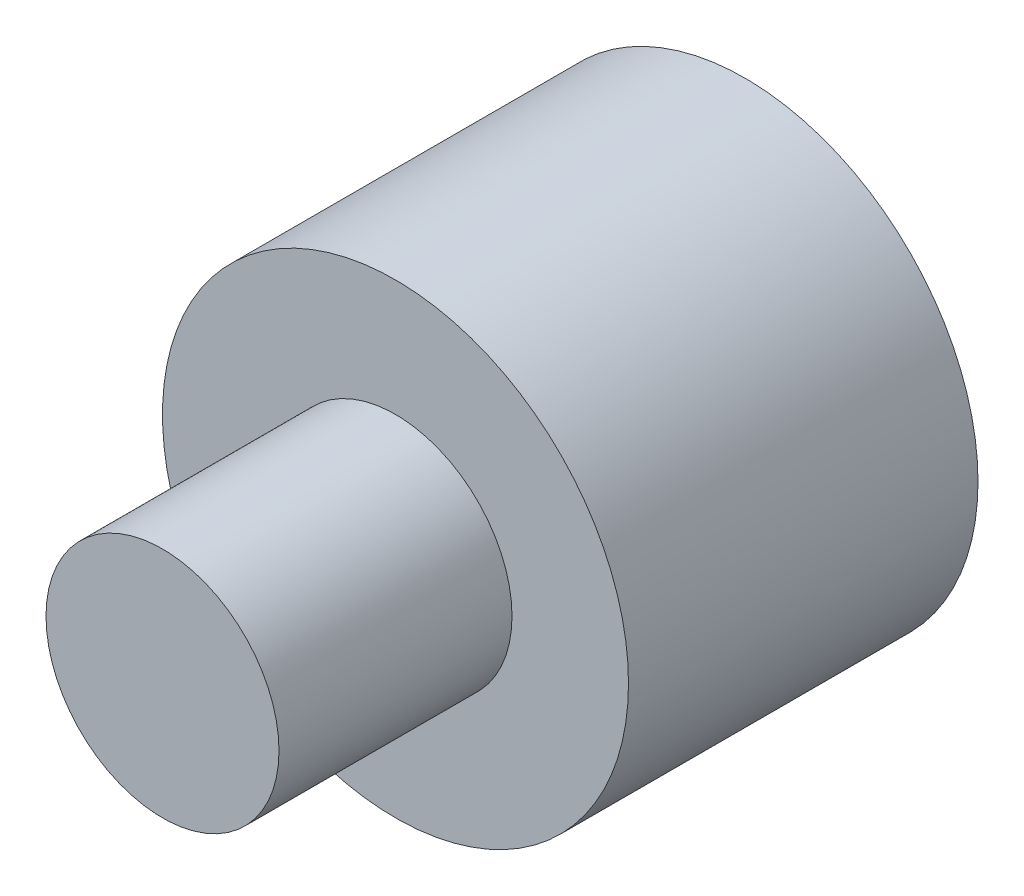
from build123d import *

# Parameters (mm, degrees)
SKETCH1_R           = 20
BOSS_EXTRUDE1_DEPTH = 30
SKETCH2_R           = 10
BOSS_EXTRUDE2_DEPTH = 20


with BuildPart() as part:
    # Sketch1 → Boss-Extrude1 (new body)
    with BuildSketch(Plane.XY):
        Circle(SKETCH1_R)
    extrude(amount=BOSS_EXTRUDE1_DEPTH)

    # Sketch2 → Boss-Extrude2 (add)
    with BuildSketch(Plane.XY.offset(30)):
        Circle(SKETCH2_R)
    extrude(amount=BOSS_EXTRUDE2_DEPTH)


solid = part.part
